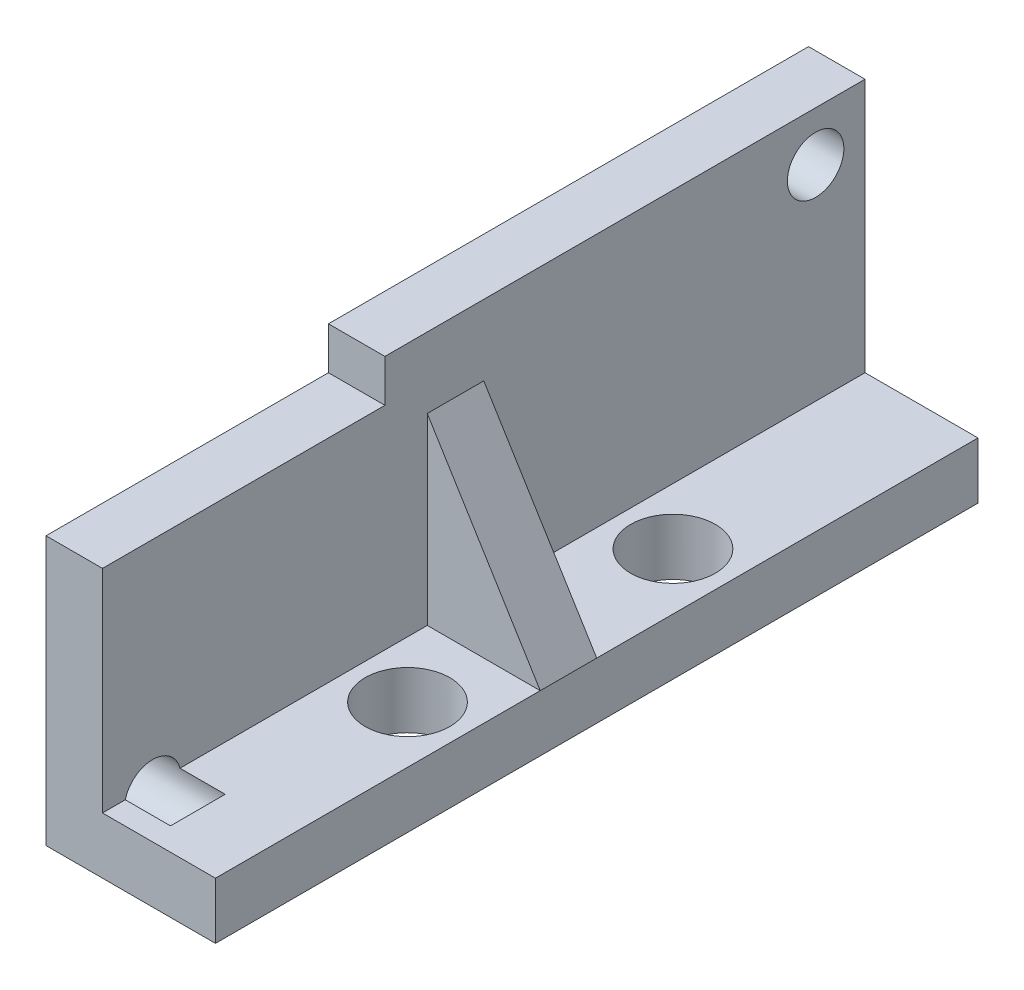
from build123d import *

# Parameters (mm, degrees)
BOSS_EXTRUDE1_DEPTH = 13.5
SKETCH2_W           = 10
SKETCH2_H           = 1.5
CUT_EXTRUDE1_DEPTH  = 27
SKETCH3_R           = 1
CUT_EXTRUDE2_DEPTH  = 3.6
SKETCH4_W           = 6
SKETCH4_H           = 2
BOSS_EXTRUDE2_DEPTH = 3
SKETCH5_R           = 1.5
CUT_EXTRUDE3_DEPTH  = 9
BOSS_EXTRUDE3_DEPTH = 2
SKETCH8_W           = 6
SKETCH8_H           = 3
CUT_EXTRUDE4_DEPTH  = 10


with BuildPart() as part:
    # Sketch1 → Boss-Extrude1 (new, symmetric)
    with BuildSketch(Plane.XY):
        Polygon((0, 11), (0, 0), (6, 0), (6, 2), (2, 2), (2, 11), align=None)
    extrude(amount=BOSS_EXTRUDE1_DEPTH, both=True)

    # Sketch2 → Cut-Extrude1 (cut)
    with BuildSketch(Plane(origin=(2, 0, 0), x_dir=(0, 0, -1), z_dir=(1, 0, 0))):
        with Locations((-8.5, 10.25)):
            Rectangle(SKETCH2_W, SKETCH2_H)
    extrude(amount=-CUT_EXTRUDE1_DEPTH, mode=Mode.SUBTRACT)

    # Sketch3 → Cut-Extrude2 (cut)
    with BuildSketch(Plane.ZY):
        with Locations(Location((-11.75, 9.25, 0), (0, 0, 270))):
            Circle(SKETCH3_R)
        with Locations(Location((11.723777669, 1.75, 0), (0, 0, 270))):
            Circle(SKETCH3_R)
    extrude(amount=-CUT_EXTRUDE2_DEPTH, mode=Mode.SUBTRACT)

    # Sketch4 → Boss-Extrude2 (add)
    with BuildSketch(Plane.XY.offset(13.5)):
        with Locations((3, 1)):
            Rectangle(SKETCH4_W, SKETCH4_H)
    extrude(amount=BOSS_EXTRUDE2_DEPTH)

    # Sketch5 → Cut-Extrude3 (cut)
    with BuildSketch(Plane(origin=(0, 2, 0), x_dir=(1, 0, 0), z_dir=(0, 1, 0))):
        with Locations(Location((4, 4.7, 0), (0, 0, 180))):
            Circle(SKETCH5_R)
        with Locations(Location((4, -4.7, 0), (0, 0, 270))):
            Circle(SKETCH5_R)
    extrude(amount=-CUT_EXTRUDE3_DEPTH, mode=Mode.SUBTRACT)

    # Sketch7 → Boss-Extrude3 (add)
    with BuildSketch(Plane.XY):
        Polygon((2, 8.5), (6, 2), (2, 2), align=None)
    extrude(amount=BOSS_EXTRUDE3_DEPTH)

    # Sketch8 → Cut-Extrude4 (cut)
    with BuildSketch(Plane(origin=(0, 2, 0), x_dir=(1, 0, 0), z_dir=(0, 1, 0))):
        with Locations((3, -15)):
            Rectangle(SKETCH8_W, SKETCH8_H)
    extrude(amount=-CUT_EXTRUDE4_DEPTH, mode=Mode.SUBTRACT)


solid = part.part
